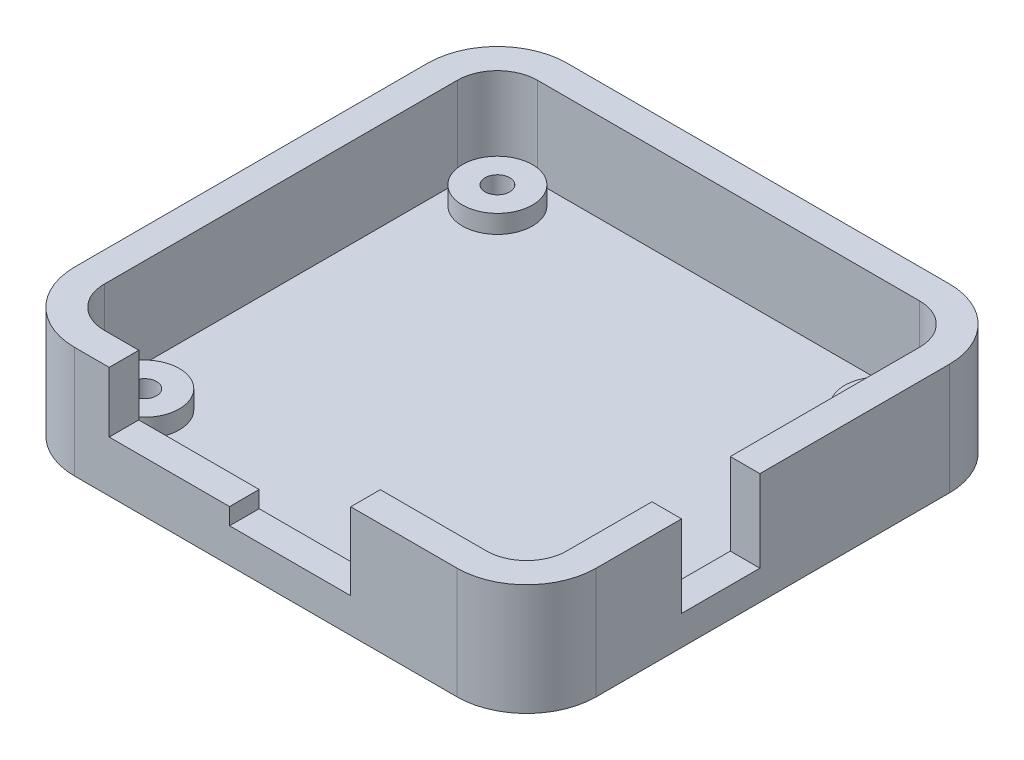
from build123d import *

# Parameters (mm, degrees)
SKETCH1_R           = 3.55
SKETCH1_R_2         = 1.25
BOSS_EXTRUDE1_DEPTH = 2.3
BOSS_EXTRUDE2_START = 2.3
SKETCH1_3_R         = 3.55
SKETCH1_3_R_2       = 1.25
BOSS_EXTRUDE2_DEPTH = 1.85
BOSS_EXTRUDE3_START = 2.3
BOSS_EXTRUDE3_DEPTH = 9
CUT_EXTRUDE3_REACH  = 73.238
SKETCH2_W           = 7.938
SKETCH2_H           = 8.3
CUT_EXTRUDE4_REACH  = 73.092
SKETCH3_W           = 13.048
SKETCH3_H           = 6.12
CUT_EXTRUDE5_REACH  = 73.092
SKETCH4_W           = 12.28
SKETCH4_H           = 7.81


with BuildPart() as part:
    # Sketch1 → Boss-Extrude1 (new body)
    # profile 1 of 7: a face of its own
    with BuildSketch(Plane(origin=(0, 0, 0), x_dir=(1, 0, 0), z_dir=(0, 1, 0))):
        with BuildLine():
            ThreePointArc((-3.5, -3.556), (-1.433345448, 1.433345448), (3.556, 3.5))
            Line((3.556, 3.5), (42.304, 3.5))
            ThreePointArc((42.304, 3.5), (47.293345448, 1.433345448), (49.36, -3.556))
            Line((49.36, -3.556), (49.36, -39.344))
            ThreePointArc((49.36, -39.344), (47.293345448, -44.333345448), (42.304, -46.4))
            Line((42.304, -46.4), (3.556, -46.4))
            ThreePointArc((3.556, -46.4), (-1.433345448, -44.333345448), (-3.5, -39.344))
            Line((-3.5, -39.344), (-3.5, -3.556))
        make_face()
        with BuildLine():
            Line((-0.5, -3.556), (-0.5, -39.344))
            ThreePointArc((-0.5, -39.344), (0.687974896, -42.212025104), (3.556, -43.4))
            Line((3.556, -43.4), (42.304, -43.4))
            ThreePointArc((42.304, -43.4), (45.172025104, -42.212025104), (46.36, -39.344))
            Line((46.36, -39.344), (46.36, -3.556))
            ThreePointArc((46.36, -3.556), (45.172025104, -0.687974896), (42.304, 0.5))
            Line((42.304, 0.5), (3.556, 0.5))
            ThreePointArc((3.556, 0.5), (0.687974896, -0.687974896), (-0.5, -3.556))
        make_face(mode=Mode.SUBTRACT)
    # profile 2 of 7: a face of its own
    with BuildSketch(Plane(origin=(0, 0, 0), x_dir=(1, 0, 0), z_dir=(0, 1, 0))):
        with BuildLine():
            ThreePointArc((-0.5, -3.556), (0.687974896, -0.687974896), (3.556, 0.5))
            Line((3.556, 0.5), (42.304, 0.5))
            ThreePointArc((42.304, 0.5), (45.172025104, -0.687974896), (46.36, -3.556))
            Line((46.36, -3.556), (46.36, -39.344))
            ThreePointArc((46.36, -39.344), (45.172025104, -42.212025104), (42.304, -43.4))
            Line((42.304, -43.4), (3.556, -43.4))
            ThreePointArc((3.556, -43.4), (0.687974896, -42.212025104), (-0.5, -39.344))
            Line((-0.5, -39.344), (-0.5, -3.556))
        make_face()
        with BuildLine():
            Line((0, -3.556), (0, -39.344))
            ThreePointArc((0, -39.344), (1.041528286, -41.858471714), (3.556, -42.9))
            Line((3.556, -42.9), (42.304, -42.9))
            ThreePointArc((42.304, -42.9), (44.818471714, -41.858471714), (45.86, -39.344))
            Line((45.86, -39.344), (45.86, -3.556))
            ThreePointArc((45.86, -3.556), (44.818471714, -1.041528286), (42.304, 0))
            Line((42.304, 0), (3.556, 0))
            ThreePointArc((3.556, 0), (1.041528286, -1.041528286), (0, -3.556))
        make_face(mode=Mode.SUBTRACT)
    # profile 3 of 7: a face of its own
    with BuildSketch(Plane(origin=(0, 0, 0), x_dir=(1, 0, 0), z_dir=(0, 1, 0))):
        with BuildLine():
            ThreePointArc((0, -3.556), (1.041528286, -1.041528286), (3.556, 0))
            Line((3.556, 0), (42.304, 0))
            ThreePointArc((42.304, 0), (44.818471714, -1.041528286), (45.86, -3.556))
            Line((45.86, -3.556), (45.86, -39.344))
            ThreePointArc((45.86, -39.344), (44.818471714, -41.858471714), (42.304, -42.9))
            Line((42.304, -42.9), (3.556, -42.9))
            ThreePointArc((3.556, -42.9), (1.041528286, -41.858471714), (0, -39.344))
            Line((0, -39.344), (0, -3.556))
        make_face()
        with Locations((3.556, -39.344)):
            Circle(SKETCH1_R, mode=Mode.SUBTRACT)
        with Locations((42.304, -39.344)):
            Circle(SKETCH1_R, mode=Mode.SUBTRACT)
        with Locations((42.304, -3.556)):
            Circle(SKETCH1_R, mode=Mode.SUBTRACT)
        with Locations((3.556, -3.556)):
            Circle(SKETCH1_R, mode=Mode.SUBTRACT)
    # profile 4 of 7: a face of its own
    with BuildSketch(Plane(origin=(0, 0, 0), x_dir=(1, 0, 0), z_dir=(0, 1, 0))):
        with Locations((42.304, -39.344)):
            Circle(SKETCH1_R)
        with Locations(Location((42.304, -39.344, 0), (0, 0, 270))):
            Circle(SKETCH1_R_2, mode=Mode.SUBTRACT)
    # profile 5 of 7: a face of its own
    with BuildSketch(Plane(origin=(0, 0, 0), x_dir=(1, 0, 0), z_dir=(0, 1, 0))):
        with Locations((3.556, -39.344)):
            Circle(SKETCH1_R)
        with Locations(Location((3.556, -39.344, 0), (0, 0, 270))):
            Circle(SKETCH1_R_2, mode=Mode.SUBTRACT)
    # profile 6 of 7: a face of its own
    with BuildSketch(Plane(origin=(0, 0, 0), x_dir=(1, 0, 0), z_dir=(0, 1, 0))):
        with Locations((3.556, -3.556)):
            Circle(SKETCH1_R)
        with Locations(Location((3.556, -3.556, 0), (0, 0, 270))):
            Circle(SKETCH1_R_2, mode=Mode.SUBTRACT)
    # profile 7 of 7: a face of its own
    with BuildSketch(Plane(origin=(0, 0, 0), x_dir=(1, 0, 0), z_dir=(0, 1, 0))):
        with Locations((42.304, -3.556)):
            Circle(SKETCH1_R)
        with Locations(Location((42.304, -3.556, 0), (0, 0, 270))):
            Circle(SKETCH1_R_2, mode=Mode.SUBTRACT)
    extrude(amount=BOSS_EXTRUDE1_DEPTH)

    # Sketch1<3> → Boss-Extrude2 (add)
    # profile 1 of 4: a face of its own
    with BuildSketch(Plane(origin=(0, 0, 0), x_dir=(1, 0, 0), z_dir=(0, 1, 0)).offset(BOSS_EXTRUDE2_START)):
        with Locations(Location((3.556, -3.556, 0), (0, 0, 270))):
            Circle(SKETCH1_3_R)
        with Locations(Location((3.556, -3.556, 0), (0, 0, 270))):
            Circle(SKETCH1_3_R_2, mode=Mode.SUBTRACT)
    # profile 2 of 4: a face of its own
    with BuildSketch(Plane(origin=(0, 0, 0), x_dir=(1, 0, 0), z_dir=(0, 1, 0)).offset(BOSS_EXTRUDE2_START)):
        with Locations(Location((42.304, -3.556, 0), (0, 0, 270))):
            Circle(SKETCH1_3_R)
        with Locations(Location((42.304, -3.556, 0), (0, 0, 270))):
            Circle(SKETCH1_3_R_2, mode=Mode.SUBTRACT)
    # profile 3 of 4: a face of its own
    with BuildSketch(Plane(origin=(0, 0, 0), x_dir=(1, 0, 0), z_dir=(0, 1, 0)).offset(BOSS_EXTRUDE2_START)):
        with Locations(Location((42.304, -39.344, 0), (0, 0, 270))):
            Circle(SKETCH1_3_R)
        with Locations(Location((42.304, -39.344, 0), (0, 0, 270))):
            Circle(SKETCH1_3_R_2, mode=Mode.SUBTRACT)
    # profile 4 of 4: a face of its own
    with BuildSketch(Plane(origin=(0, 0, 0), x_dir=(1, 0, 0), z_dir=(0, 1, 0)).offset(BOSS_EXTRUDE2_START)):
        with Locations(Location((3.556, -39.344, 0), (0, 0, 270))):
            Circle(SKETCH1_3_R)
        with Locations(Location((3.556, -39.344, 0), (0, 0, 270))):
            Circle(SKETCH1_3_R_2, mode=Mode.SUBTRACT)
    extrude(amount=BOSS_EXTRUDE2_DEPTH)

    # Sketch1<4> → Boss-Extrude3 (add)
    with BuildSketch(Plane(origin=(0, 0, 0), x_dir=(1, 0, 0), z_dir=(0, 1, 0)).offset(BOSS_EXTRUDE3_START)):
        with BuildLine():
            ThreePointArc((-3.5, -3.556), (-1.433345448, 1.433345448), (3.556, 3.5))
            Line((3.556, 3.5), (42.304, 3.5))
            ThreePointArc((42.304, 3.5), (47.293345448, 1.433345448), (49.36, -3.556))
            Line((49.36, -3.556), (49.36, -39.344))
            ThreePointArc((49.36, -39.344), (47.293345448, -44.333345448), (42.304, -46.4))
            Line((42.304, -46.4), (3.556, -46.4))
            ThreePointArc((3.556, -46.4), (-1.433345448, -44.333345448), (-3.5, -39.344))
            Line((-3.5, -39.344), (-3.5, -3.556))
        make_face()
        with BuildLine():
            Line((-0.5, -3.556), (-0.5, -39.344))
            ThreePointArc((-0.5, -39.344), (0.687974896, -42.212025104), (3.556, -43.4))
            Line((3.556, -43.4), (42.304, -43.4))
            ThreePointArc((42.304, -43.4), (45.172025104, -42.212025104), (46.36, -39.344))
            Line((46.36, -39.344), (46.36, -3.556))
            ThreePointArc((46.36, -3.556), (45.172025104, -0.687974896), (42.304, 0.5))
            Line((42.304, 0.5), (3.556, 0.5))
            ThreePointArc((3.556, 0.5), (0.687974896, -0.687974896), (-0.5, -3.556))
        make_face(mode=Mode.SUBTRACT)
    extrude(amount=BOSS_EXTRUDE3_DEPTH)

    # Sketch2 → Cut-Extrude3 (cut, up to next)
    with BuildSketch(Plane(origin=(49.36, 0, 0), x_dir=(0, 0, -1), z_dir=(1, 0, 0)), mode=Mode.PRIVATE) as cut_extrude3_sk1:
        with Locations((-26.725, 7.15)):
            Rectangle(SKETCH2_W, SKETCH2_H)
    cut_extrude3_tool1 = extrude(cut_extrude3_sk1.sketch, amount=-CUT_EXTRUDE3_REACH, mode=Mode.PRIVATE) & part.part
    add(cut_extrude3_tool1.solids().sort_by_distance((49.36, 7.15, 26.725))[0], mode=Mode.SUBTRACT)

    # Sketch3 → Cut-Extrude4 (cut, up to next)
    with BuildSketch(Plane.XY.offset(46.4), mode=Mode.PRIVATE) as cut_extrude4_sk1:
        with Locations((13.58, 8.24)):
            Rectangle(SKETCH3_W, SKETCH3_H)
    cut_extrude4_tool1 = extrude(cut_extrude4_sk1.sketch, amount=-CUT_EXTRUDE4_REACH, mode=Mode.PRIVATE) & part.part
    add(cut_extrude4_tool1.solids().sort_by_distance((13.58, 8.24, 46.4))[0], mode=Mode.SUBTRACT)

    # Sketch4 → Cut-Extrude5 (cut, up to next)
    with BuildSketch(Plane.XY.offset(46.4), mode=Mode.PRIVATE) as cut_extrude5_sk1:
        with Locations((25.394, 7.395)):
            Rectangle(SKETCH4_W, SKETCH4_H)
    cut_extrude5_tool1 = extrude(cut_extrude5_sk1.sketch, amount=-CUT_EXTRUDE5_REACH, mode=Mode.PRIVATE) & part.part
    add(cut_extrude5_tool1.solids().sort_by_distance((25.394, 7.395, 46.4))[0], mode=Mode.SUBTRACT)


solid = part.part
